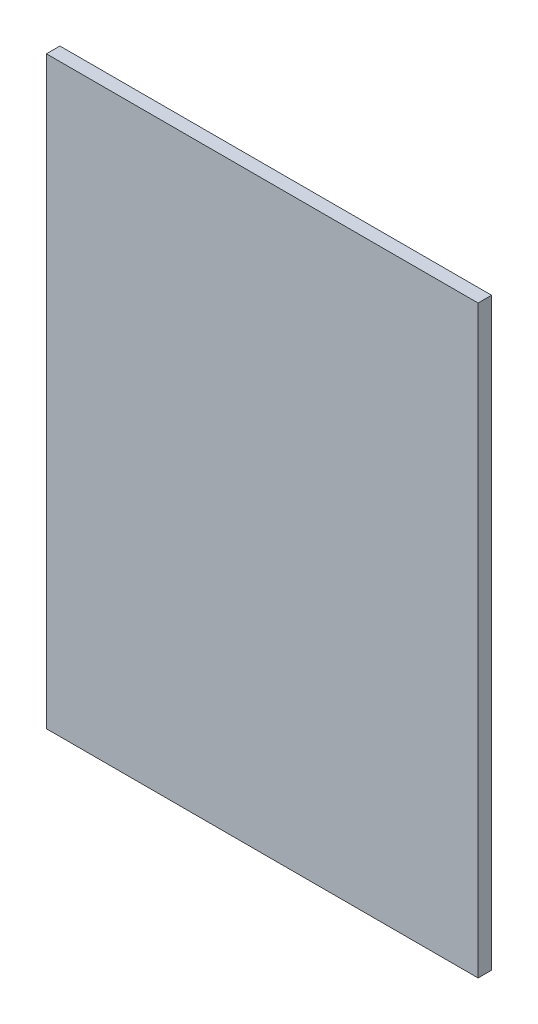
from build123d import *

# Parameters (mm, degrees)
SKETCH1_W           = 96
SKETCH1_H           = 130
BOSS_EXTRUDE1_DEPTH = 3


with BuildPart() as part:
    # Sketch1 → Boss-Extrude1 (new body)
    with BuildSketch(Plane.XY):
        with Locations((18.513409962, -13.314176245)):
            Rectangle(SKETCH1_W, SKETCH1_H)
    extrude(amount=BOSS_EXTRUDE1_DEPTH)


solid = part.part
